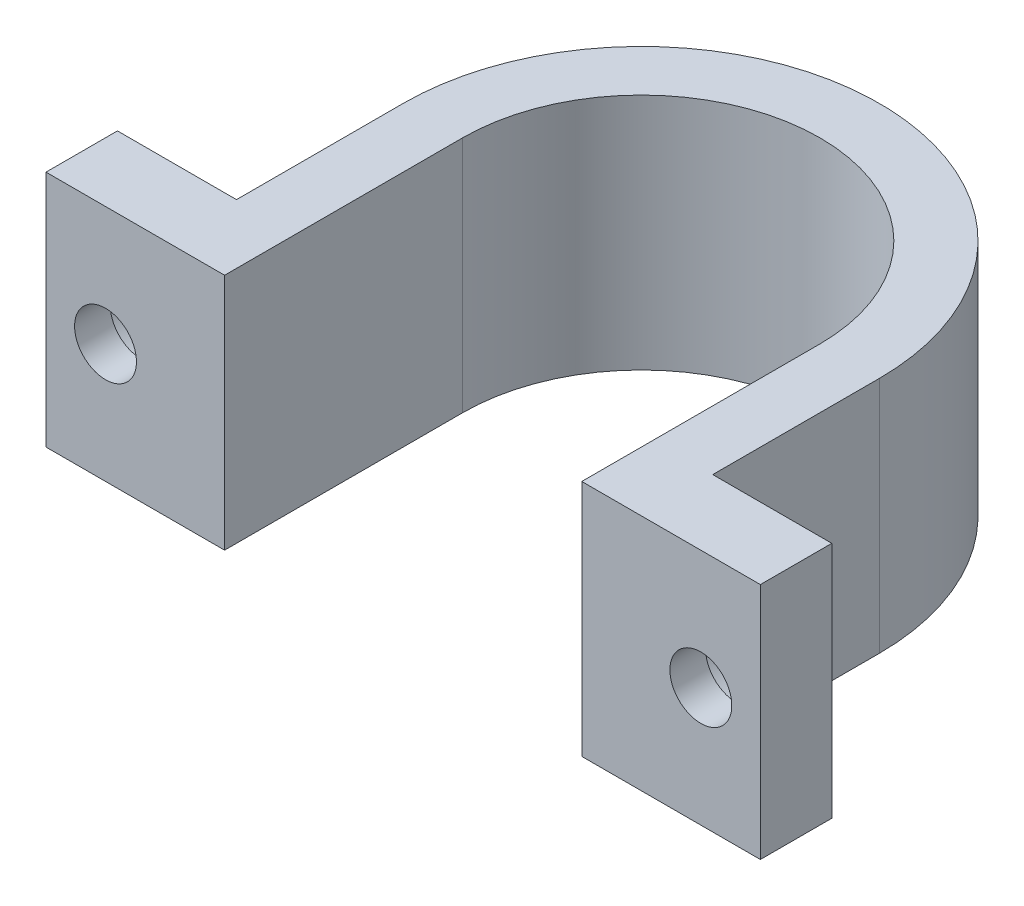
from build123d import *

# Parameters (mm, degrees)
EXTRUDE_1_DEPTH     = 20
CUT_EXTRUDE_1_DEPTH = 20
SKETCH_4_R          = 4.9
CUT_EXTRUDE_3_DEPTH = 3


with BuildPart() as part:
    # 草图1 → 凸台-拉伸1 (new body)
    with BuildSketch(Plane(origin=(0, 0, 0), x_dir=(1, 0, 0), z_dir=(0, 1, 0))):
        with BuildLine():
            Line((15, 0), (20, 0))
            Line((20, 0), (30, 0))
            Line((30, 0), (30, 6))
            Line((30, 6), (20, 6))
            Line((20, 6), (20, 20))
            ThreePointArc((20, 20), (0, 40), (-20, 20))
            Line((-20, 20), (-20, 6))
            Line((-20, 6), (-30, 6))
            Line((-30, 6), (-30, 0))
            Line((-30, 0), (-20, 0))
            Line((-20, 0), (-15, 0))
            Line((-15, 0), (-15, 20))
            ThreePointArc((-15, 20), (0, 35), (15, 20))
            Line((15, 20), (15, 0))
        make_face()
    extrude(amount=EXTRUDE_1_DEPTH)

    # 草图3 → 切除-拉伸1 (cut)
    with BuildSketch(Plane(origin=(0, 0, -6), x_dir=(-1, 0, 0), z_dir=(0, 0, -1))):
        with BuildLine():
            ThreePointArc((27.6, 10), (26.366900892, 12.211692102), (23.837244652, 12.325510697))
            Line((23.837244652, 12.325510697), (26.162755348, 7.674489303))
            ThreePointArc((26.162755348, 7.674489303), (27.211692102, 8.633099108), (27.6, 10))
        make_face()
        with BuildLine():
            Line((26.162755348, 7.674489303), (23.837244652, 12.325510697))
            ThreePointArc((23.837244652, 12.325510697), (22.674489303, 8.837244652), (26.162755348, 7.674489303))
        make_face()
        with BuildLine():
            ThreePointArc((-22.4, 10), (-23.633099108, 12.211692102), (-26.162755348, 12.325510697))
            Line((-26.162755348, 12.325510697), (-23.837244652, 7.674489303))
            ThreePointArc((-23.837244652, 7.674489303), (-22.788307898, 8.633099108), (-22.4, 10))
        make_face()
        with BuildLine():
            Line((-23.837244652, 7.674489303), (-26.162755348, 12.325510697))
            ThreePointArc((-26.162755348, 12.325510697), (-27.325510697, 8.837244652), (-23.837244652, 7.674489303))
        make_face()
    extrude(amount=-CUT_EXTRUDE_1_DEPTH, mode=Mode.SUBTRACT)

    # 草图4 → 切除-拉伸3 (cut)
    with BuildSketch(Plane(origin=(0, 0, -6), x_dir=(-1, 0, 0), z_dir=(0, 0, -1))):
        with Locations((-25, 10)):
            Circle(SKETCH_4_R)
        with Locations((25, 10)):
            Circle(SKETCH_4_R)
    extrude(amount=-CUT_EXTRUDE_3_DEPTH, mode=Mode.SUBTRACT)


solid = part.part
